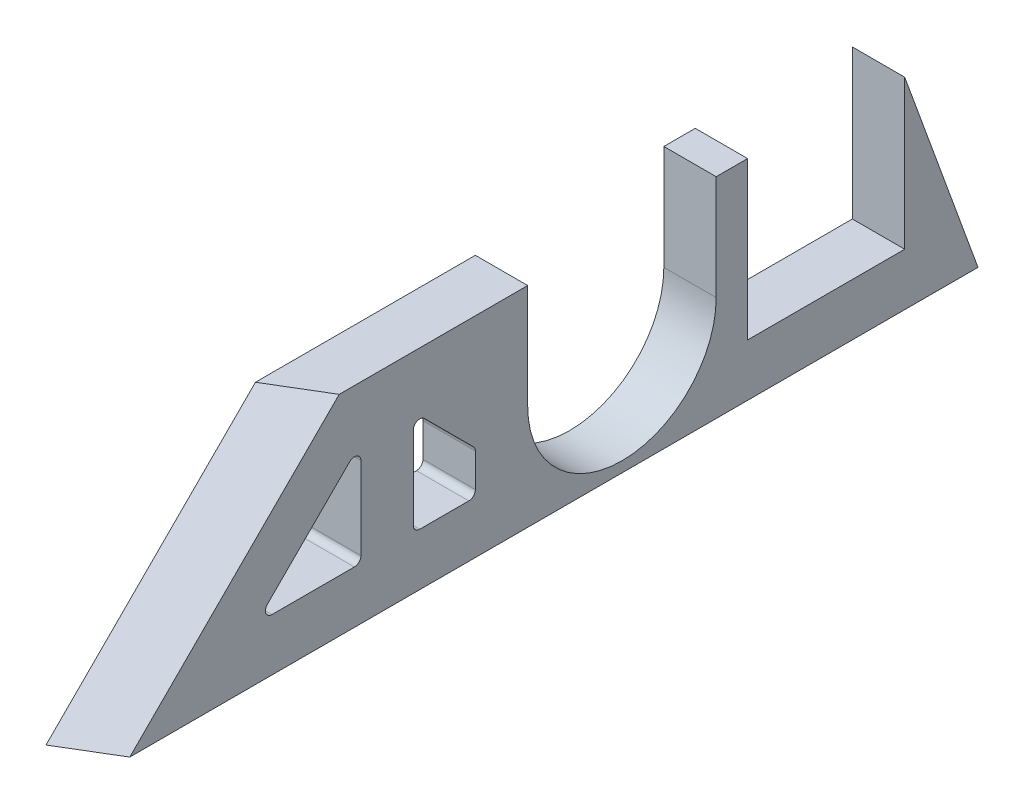
from build123d import *

# Parameters (mm, degrees)
BOSS_EXTRUDE1_DEPTH = 12.7
CUT_EXTRUDE1_DEPTH  = 71.842048969
CUT_EXTRUDE2_REACH  = 120.838
FILLET1_R           = 1.5875


with BuildPart() as part:
    # Sketch1 → Boss-Extrude1 (new body)
    with BuildSketch(Plane(origin=(0, 0, 0), x_dir=(0, 0, -1), z_dir=(1, 0, 0))):
        with BuildLine():
            Line((-55.88, 50.8), (-106.68, 0))
            Line((-106.68, 0), (106.68, 0))
            Line((106.68, 0), (88.9, 48.850148518))
            Line((88.9, 48.850148518), (88.9, 12.7))
            Line((88.9, 12.7), (50.8, 12.7))
            Line((50.8, 12.7), (50.8, 50.8))
            Line((50.8, 50.8), (43.18, 50.8))
            Line((43.18, 50.8), (43.18, 25.4))
            ThreePointArc((43.18, 25.4), (20.32, 2.54), (-2.54, 25.4))
            Line((-2.54, 25.4), (-2.54, 50.8))
            Line((-2.54, 50.8), (-55.88, 50.8))
        make_face()
    extrude(amount=BOSS_EXTRUDE1_DEPTH)

    # Sketch2 → Cut-Extrude1 (cut, along a direction that is not the sketch's normal)
    with BuildSketch(Plane.XZ):
        Polygon((0, 106.68), (12.7, 106.68), (12.7, 99.06), align=None)
    extrude(amount=-CUT_EXTRUDE1_DEPTH, dir=(0, -0.7071067811865438, 0.7071067811865512), mode=Mode.SUBTRACT)

    # Sketch3 → Cut-Extrude2 (cut, up to next)
    with BuildSketch(Plane(origin=(12.7, 0, 0), x_dir=(0, 0, -1), z_dir=(1, 0, 0)), mode=Mode.PRIVATE) as cut_extrude2_sk1:
        Polygon((-42.999487758, 12.7), (-68.399487758, 12.7), (-42.999487758, 38.1), align=None)
    cut_extrude2_tool1 = extrude(cut_extrude2_sk1.sketch, amount=-CUT_EXTRUDE2_REACH, mode=Mode.PRIVATE) & part.part
    # Sketch3 → Cut-Extrude2 (cut, up to next)
    with BuildSketch(Plane(origin=(12.7, 0, 0), x_dir=(0, 0, -1), z_dir=(1, 0, 0)), mode=Mode.PRIVATE) as cut_extrude2_sk2:
        Polygon((-15.24, 23.040512242), (-30.299487758, 38.1), (-30.299487758, 12.7), (-15.24, 12.7), align=None)
    cut_extrude2_tool2 = extrude(cut_extrude2_sk2.sketch, amount=-CUT_EXTRUDE2_REACH, mode=Mode.PRIVATE) & part.part
    add(cut_extrude2_tool1.solids().sort_by_distance((12.7, 21.166667, 51.466154))[0], mode=Mode.SUBTRACT)
    add(cut_extrude2_tool2.solids().sort_by_distance((12.7, 22.163912, 23.827312))[0], mode=Mode.SUBTRACT)

    # Fillet1
    fillet1_edges = [part.edges().sort_by_distance(p)[0] for p in [
        (6.35, 12.7, 42.999487758),
        (6.35, 12.7, 68.399487758),
        (6.35, 38.1, 42.999487758),
        (6.35, 23.040512242, 15.24),
        (6.35, 12.7, 15.24),
        (6.35, 12.7, 30.299487758),
        (6.35, 38.1, 30.299487758),
    ]]
    fillet(fillet1_edges, radius=FILLET1_R)


solid = part.part
